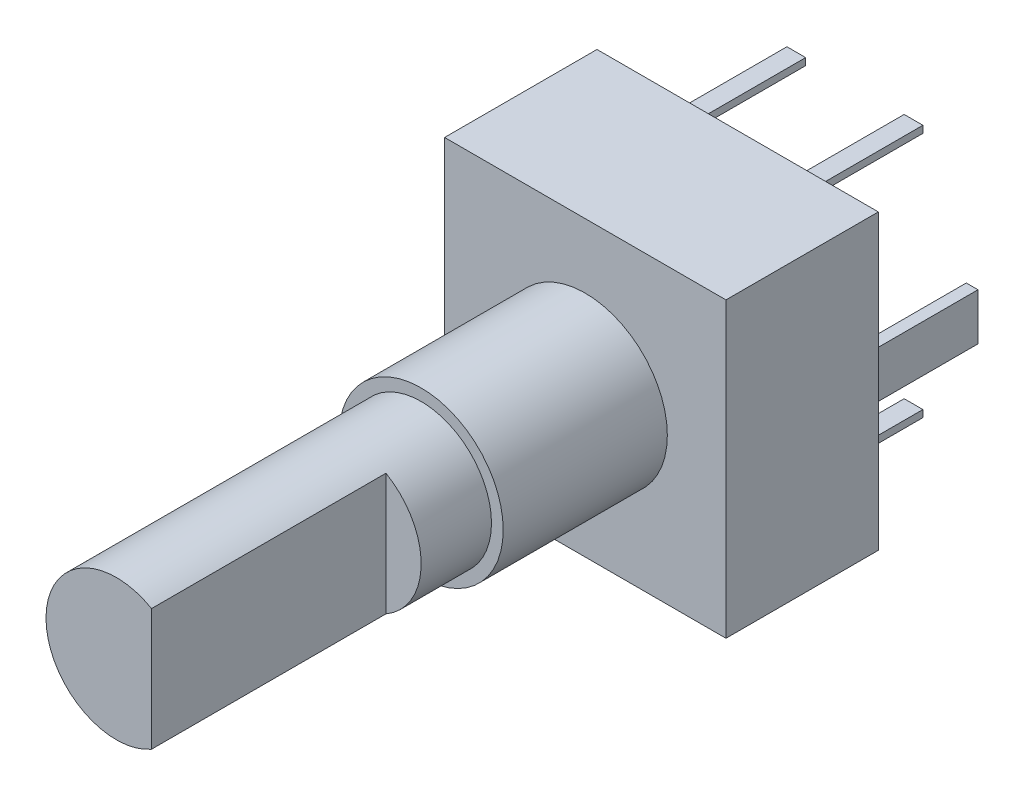
from build123d import *

# Parameters (mm, degrees)
SKETCH1_W     = 12
SKETCH1_H     = 12.5
BODY_DEPTH    = 6.5
SKETCH2_R     = 3.5
BUSHING_DEPTH = 7
SKETCH3_R     = 3
SHAFT_DEPTH   = 13
SKETCH4_W     = 0.8
SKETCH4_H     = 0.3
PINS_DEPTH    = 5
SKETCH5_W     = 0.5
SKETCH5_H     = 2
TABS_DEPTH    = 4.5
SKETCH6_W     = 4
SKETCH6_H     = 8
D_FLAT_DEPTH  = 10


with BuildPart() as part:
    # Sketch1 → Body (new body)
    with BuildSketch(Plane.XY):
        Rectangle(SKETCH1_W, SKETCH1_H)
    extrude(amount=BODY_DEPTH)

    # Sketch2 → Bushing (add)
    with BuildSketch(Plane.XY.offset(6.5)):
        Circle(SKETCH2_R)
    extrude(amount=BUSHING_DEPTH)

    # Sketch3 → Shaft (add)
    with BuildSketch(Plane.XY.offset(13.5)):
        Circle(SKETCH3_R)
    extrude(amount=SHAFT_DEPTH)

    # Sketch4 → Pins (add)
    with BuildSketch(Plane.XY):
        with Locations((-2.5, -5.25)):
            Rectangle(SKETCH4_W, SKETCH4_H)
        with Locations((0, -5.25)):
            Rectangle(SKETCH4_W, SKETCH4_H)
        with Locations((2.5, -5.25)):
            Rectangle(SKETCH4_W, SKETCH4_H)
        with Locations((-2.5, 5.25)):
            Rectangle(SKETCH4_W, SKETCH4_H)
        with Locations((2.5, 5.25)):
            Rectangle(SKETCH4_W, SKETCH4_H)
    extrude(amount=-PINS_DEPTH)

    # Sketch5 → Tabs (add)
    with BuildSketch(Plane.XY):
        with Locations((-5.5, 0)):
            Rectangle(SKETCH5_W, SKETCH5_H)
        with Locations((5.5, 0)):
            Rectangle(SKETCH5_W, SKETCH5_H)
    extrude(amount=-TABS_DEPTH)

    # Sketch6 → D_flat (cut)
    with BuildSketch(Plane.XY.offset(26.5)):
        with Locations((3.5, 0)):
            Rectangle(SKETCH6_W, SKETCH6_H)
    extrude(amount=-D_FLAT_DEPTH, mode=Mode.SUBTRACT)


solid = part.part
